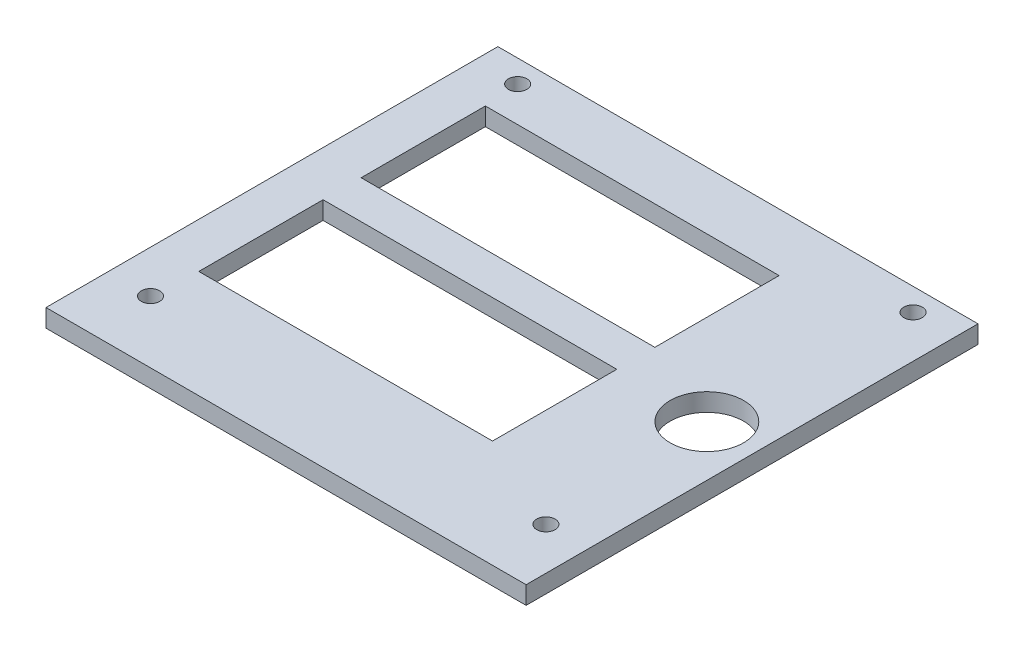
from build123d import *

# Parameters (mm, degrees)
SKETCH1_W           = 85
SKETCH1_H           = 80
SKETCH1_R           = 1.63195
SKETCH1_R_2         = 6.5
SKETCH1_W_2         = 52
SKETCH1_H_2         = 22
BOSS_EXTRUDE1_DEPTH = 3.175


with BuildPart() as part:
    # Sketch1 → Boss-Extrude1 (new body)
    with BuildSketch(Plane(origin=(0, 0, 0), x_dir=(1, 0, 0), z_dir=(0, 1, 0))):
        with Locations((42.5, -40)):
            Rectangle(SKETCH1_W, SKETCH1_H)
        with Locations(Location((7.5, -4, 0), (0, 0, 270))):
            Circle(SKETCH1_R, mode=Mode.SUBTRACT)
        with Locations(Location((7.5, -69, 0), (0, 0, 270))):
            Circle(SKETCH1_R, mode=Mode.SUBTRACT)
        with Locations(Location((77.5, -69, 0), (0, 0, 270))):
            Circle(SKETCH1_R, mode=Mode.SUBTRACT)
        with Locations(Location((77.5, -4, 0), (0, 0, 270))):
            Circle(SKETCH1_R, mode=Mode.SUBTRACT)
        with Locations(Location((76, -39, 0), (0, 0, 270))):
            Circle(SKETCH1_R_2, mode=Mode.SUBTRACT)
        with Locations((34, -49.95)):
            Rectangle(SKETCH1_W_2, SKETCH1_H_2, mode=Mode.SUBTRACT)
        with Locations((34, -21.21)):
            Rectangle(SKETCH1_W_2, SKETCH1_H_2, mode=Mode.SUBTRACT)
    extrude(amount=BOSS_EXTRUDE1_DEPTH)


solid = part.part
